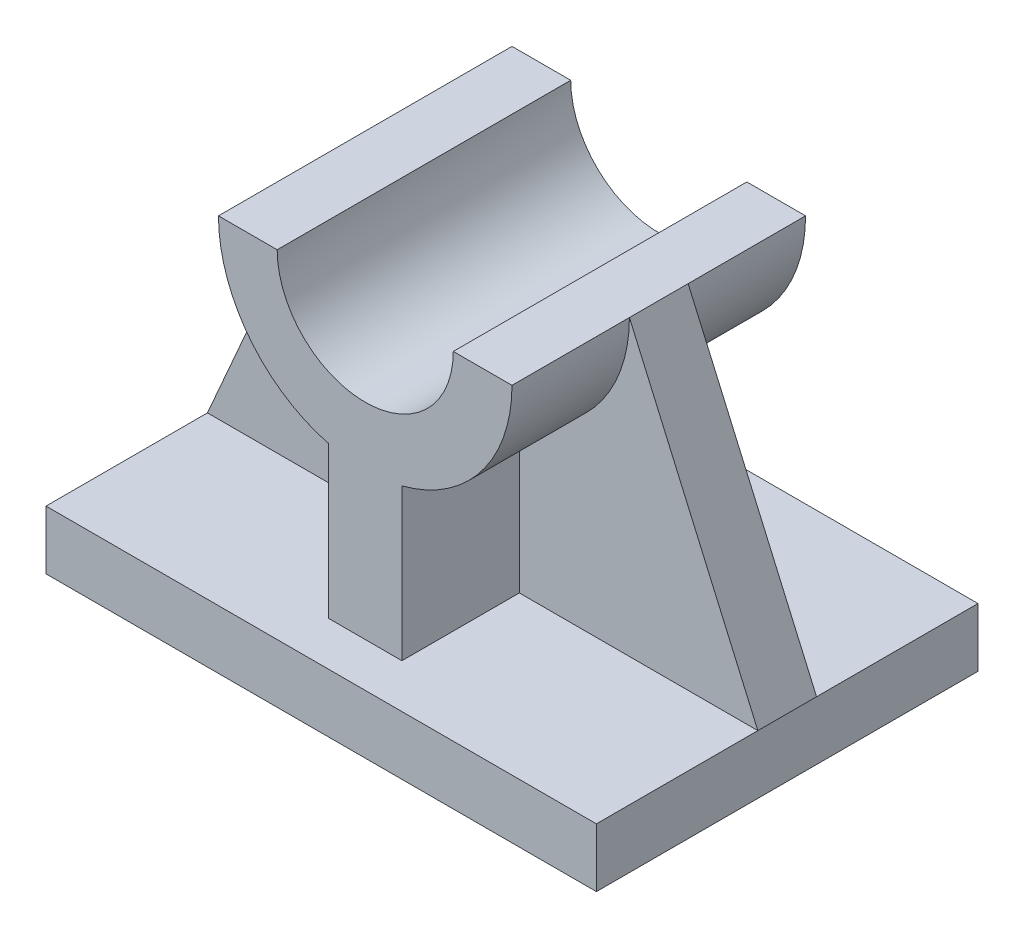
from build123d import *

# Parameters (mm, degrees)
BOSS_EXTRUDE2_DEPTH = 26
BOSS_EXTRUDE4_DEPTH = 20
BOSS_EXTRUDE5_DEPTH = 4


with BuildPart() as part:
    # Sketch1 → Boss-Extrude2 (new, symmetric)
    with BuildSketch(Plane.XY):
        Polygon((-5, -40), (-37.5, -40), (-37.5, -48), (37.5, -48), (37.5, -40), (5, -40), align=None)
    extrude(amount=BOSS_EXTRUDE2_DEPTH, both=True)

    # Sketch1<6> → Boss-Extrude4 (add, symmetric)
    with BuildSketch(Plane.XY):
        with BuildLine():
            Line((-12, 0), (-20, 0))
            ThreePointArc((-20, 0), (-15.811388301, -12.247448714), (-5, -19.364916731))
            Line((-5, -19.364916731), (-5, -40))
            Line((-5, -40), (5, -40))
            Line((5, -40), (5, -19.364916731))
            ThreePointArc((5, -19.364916731), (15.811388301, -12.247448714), (20, 0))
            Line((20, 0), (12, 0))
            ThreePointArc((12, 0), (0, -12), (-12, 0))
        make_face()
    extrude(amount=BOSS_EXTRUDE4_DEPTH, both=True)

    # Sketch1<7> → Boss-Extrude5 (add, symmetric)
    with BuildSketch(Plane.XY):
        with BuildLine():
            ThreePointArc((-5, -19.364916731), (-15.811388301, -12.247448714), (-20, 0))
            Line((-20, 0), (-37.5, -40))
            Line((-37.5, -40), (-5, -40))
            Line((-5, -40), (-5, -19.364916731))
        make_face()
        with BuildLine():
            Line((5, -19.364916731), (5, -40))
            Line((5, -40), (37.5, -40))
            Line((37.5, -40), (20, 0))
            ThreePointArc((20, 0), (15.811388301, -12.247448714), (5, -19.364916731))
        make_face()
    extrude(amount=BOSS_EXTRUDE5_DEPTH, both=True)


solid = part.part
